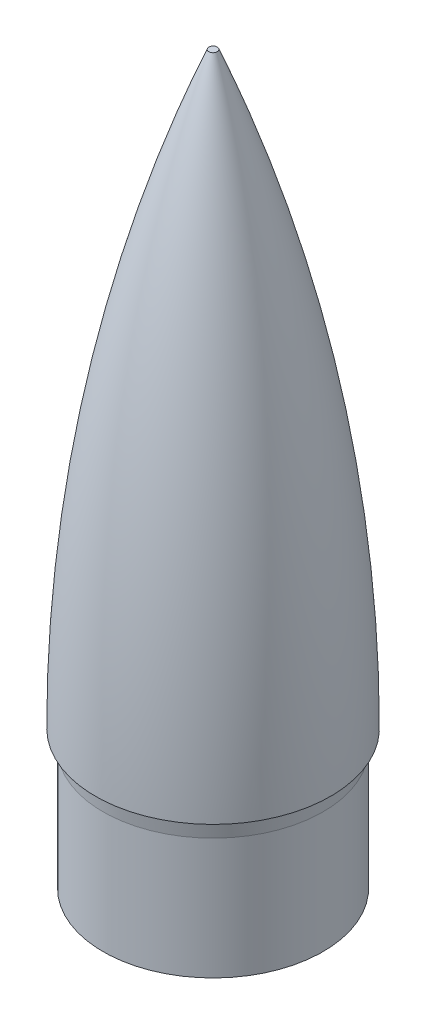
from build123d import *

# Parameters (mm, degrees)
BOSS_EXTRUDE1_DEPTH = 1
SKETCH3_R           = 3
CUT_EXTRUDE1_DEPTH  = 2


with BuildPart() as part:
    # Sketch1 → Revolve1 (revolve)
    with BuildSketch(Plane.XY, mode=Mode.PRIVATE) as revolve1_sk:
        with BuildLine():
            Line((17, 0), (16.25, 0))
            Line((16.25, 0), (15.9, -2.5))
            Line((15.9, -2.5), (15.9, -20))
            Line((15.9, -20), (15.1, -20))
            Line((15.1, -20), (15.1, 0))
            ThreePointArc((15.1, 0), (11.421802469, 40.66007364), (0.506633233, 80))
            Line((0.506633233, 80), (0, 80))
            Line((0, 80), (0, 85))
            Line((0, 85), (0.6, 85))
            ThreePointArc((0.6, 85), (12.862537161, 43.283830699), (17, 0))
        make_face()
    revolve(revolve1_sk.sketch.rotate(Axis((0, 80, 0), (0, 1, 0)), 90), axis=Axis((0, 80, 0), (0, 1, 0)))

    # Sketch2 → Boss-Extrude1 (add, symmetric)
    with BuildSketch(Plane.XY):
        with BuildLine():
            Line((-15.5, -20), (15.5, -20))
            Line((15.5, -20), (15.5, 0))
            ThreePointArc((15.5, 0), (11.790444759, 40.867924802), (0.783033246, 80.4))
            Line((0.783033246, 80.4), (-0.783033246, 80.4))
            ThreePointArc((-0.783033246, 80.4), (-11.790444759, 40.867924802), (-15.5, 0))
            Line((-15.5, 0), (-15.5, -20))
        make_face()
    extrude(amount=BOSS_EXTRUDE1_DEPTH, both=True)

    # Sketch3 → Cut-Extrude1 (cut)
    with BuildSketch(Plane(origin=(0, 0, -1), x_dir=(-1, 0, 0), z_dir=(0, 0, -1))):
        with Locations((6.9, -10)):
            Circle(SKETCH3_R)
        with Locations(Location((-6.9, -10, 0), (0, 0, 180))):
            Circle(SKETCH3_R)
    extrude(amount=-CUT_EXTRUDE1_DEPTH, mode=Mode.SUBTRACT)


solid = part.part
